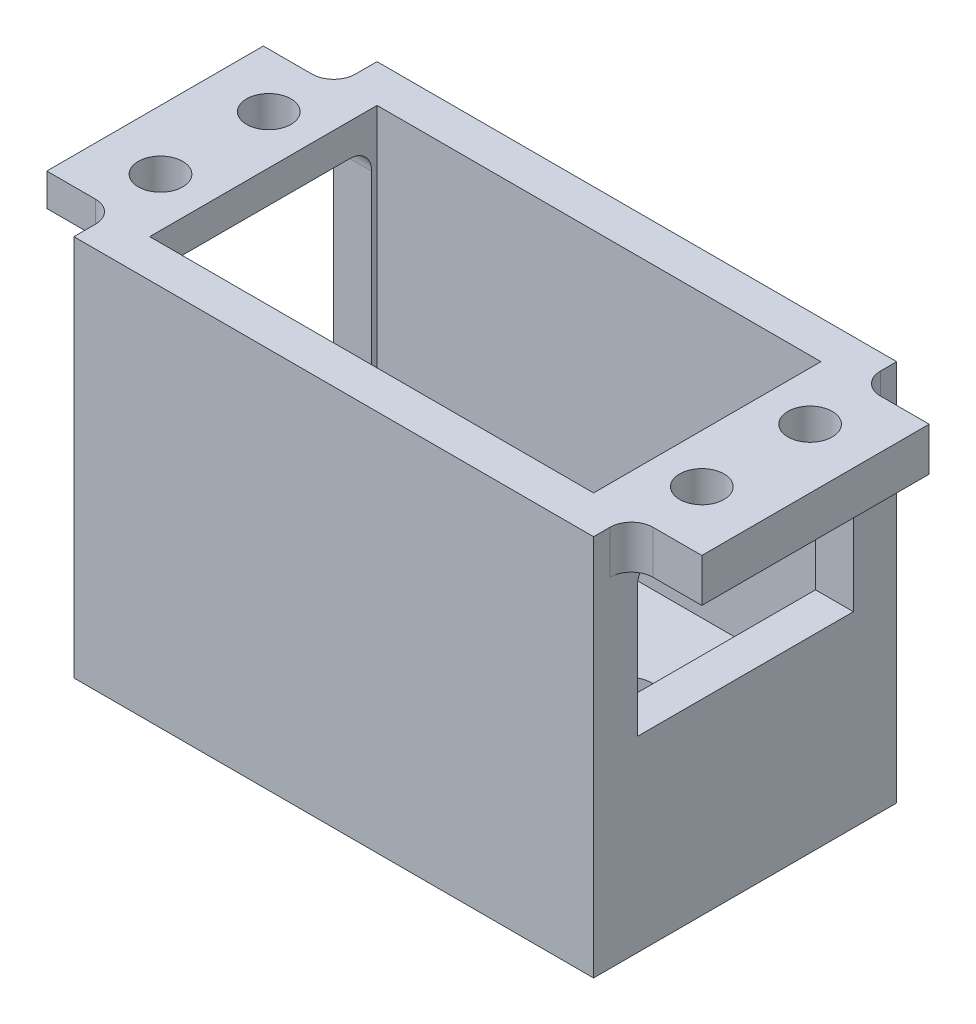
from build123d import *

# Parameters (mm, degrees)
SKETCH_1_W               = 48
SKETCH_1_H               = 28
EXTRUDE_1_DEPTH          = 9.3
SKETCH_2_W               = 48
SKETCH_2_H               = 28
SKETCH_2_W_2             = 40
SKETCH_2_H_2             = 20
EXTRUDE_2_DEPTH          = 26
SKETCH_3_W               = 41
SKETCH_3_H               = 21
CUT_EXTRUDE_1_DEPTH      = 26
SKETCH_4_W               = 19.956885432
SKETCH_4_H               = 18
CUT_EXTRUDE_2_DEPTH      = 10
CUT_EXTRUDE_3_DEPTH      = 6
SKETCH_7_W               = 20
SKETCH_7_H               = 3
EXTRUDE_4_DEPTH          = 10
FILLET_3_R               = 2
SKETCH_9_W               = 21
SKETCH_9_H               = 4
EXTRUDE_5_DEPTH          = 10
SKETCH_10_R              = 2.05
CUT_EXTRUDE_5_DEPTH      = 10
FILLET_4_R               = 2
SKETCH_11_R              = 3
CUT_EXTRUDE_6_DEPTH      = 5.3
CUT_EXTRUDE_7_DEPTH      = 46.890521897
CUT_EXTRUDE_7_DEPTH_BACK = 46.890521897
SKETCH_12_R              = 2.1
FILLET_5_R               = 2


with BuildPart() as part:
    # 草图1 → 凸台-拉伸1 (new body)
    with BuildSketch(Plane(origin=(0, 0, 0), x_dir=(1, 0, 0), z_dir=(0, 1, 0))):
        Rectangle(SKETCH_1_W, SKETCH_1_H)
    extrude(amount=EXTRUDE_1_DEPTH)

    # 草图2 → 凸台-拉伸2 (add)
    with BuildSketch(Plane(origin=(0, 9.3, 0), x_dir=(1, 0, 0), z_dir=(0, 1, 0))):
        Rectangle(SKETCH_2_W, SKETCH_2_H)
        Rectangle(SKETCH_2_W_2, SKETCH_2_H_2, mode=Mode.SUBTRACT)
    extrude(amount=EXTRUDE_2_DEPTH)

    # 草图3 → 切除-拉伸1 (cut)
    with BuildSketch(Plane(origin=(0, 35.3, 0), x_dir=(1, 0, 0), z_dir=(0, 1, 0))):
        Rectangle(SKETCH_3_W, SKETCH_3_H)
    extrude(amount=-CUT_EXTRUDE_1_DEPTH, mode=Mode.SUBTRACT)

    # 草图4 → 切除-拉伸2 (cut)
    with BuildSketch(Plane(origin=(24, 0, 0), x_dir=(0, 0, -1), z_dir=(1, 0, 0))):
        with Locations((0.021557284, 26.3)):
            Rectangle(SKETCH_4_W, SKETCH_4_H)
    extrude(amount=-CUT_EXTRUDE_2_DEPTH, mode=Mode.SUBTRACT)

    # 草图6 → 切除-拉伸3 (cut)
    with BuildSketch(Plane.ZY.offset(24)):
        Polygon((0, 35.3), (-10, 35.3), (-10, 10.3), (10, 10.3), (10, 35.3), align=None)
    extrude(amount=-CUT_EXTRUDE_3_DEPTH, mode=Mode.SUBTRACT)

    # 草图7 → 凸台-拉伸4 (add)
    with BuildSketch(Plane(origin=(-20.5, 0, 0), x_dir=(0, 0, -1), z_dir=(1, 0, 0))):
        with Locations((0, 33.8)):
            Rectangle(SKETCH_7_W, SKETCH_7_H)
    extrude(amount=-EXTRUDE_4_DEPTH)

    # 圆角3
    fillet_3_edges = [part.edges().sort_by_distance(p)[0] for p in [
        (-24, 33.8, 10),
        (-24, 33.8, -10),
    ]]
    fillet(fillet_3_edges, radius=FILLET_3_R)

    # 草图9 → 凸台-拉伸5 (add)
    with BuildSketch(Plane.ZY.offset(-20.5)):
        with Locations((0, 33.3)):
            Rectangle(SKETCH_9_W, SKETCH_9_H)
    extrude(amount=-EXTRUDE_5_DEPTH)

    # 草图10 → 切除-拉伸5 (cut)
    with BuildSketch(Plane(origin=(0, 35.3, 0), x_dir=(1, 0, 0), z_dir=(0, 1, 0))):
        with Locations(Location((25, 5, 0), (0, 0, 270))):
            Circle(SKETCH_10_R)
        with Locations(Location((25, -5, 0), (0, 0, 270))):
            Circle(SKETCH_10_R)
        with Locations(Location((-25, 5, 0), (0, 0, 270))):
            Circle(SKETCH_10_R)
        with Locations(Location((-25, -5, 0), (0, 0, 270))):
            Circle(SKETCH_10_R)
    extrude(amount=-CUT_EXTRUDE_5_DEPTH, mode=Mode.SUBTRACT)

    # 圆角4
    fillet_4_edges = [part.edges().sort_by_distance(p)[0] for p in [
        (24, 33.3, -10.5),
        (24, 33.3, 10.5),
    ]]
    fillet(fillet_4_edges, radius=FILLET_4_R)

    # 草图11 → 切除-拉伸6 (cut)
    with BuildSketch(Plane(origin=(0, 9.3, 0), x_dir=(1, 0, 0), z_dir=(0, 1, 0))):
        with Locations(Location((-14, 0, 0), (0, 0, 270))):
            Circle(SKETCH_11_R)
        with Locations(Location((12.529194913, 0, 0), (0, 0, 270))):
            Circle(SKETCH_11_R)
    extrude(amount=-CUT_EXTRUDE_6_DEPTH, mode=Mode.SUBTRACT)

    # 草图12 → 切除-拉伸7 (cut, two sides: drawn at the far end of the back side and taken through both)
    with BuildSketch(Plane(origin=(0, 4, 0), x_dir=(1, 0, 0), z_dir=(0, 1, 0)).offset(-CUT_EXTRUDE_7_DEPTH_BACK)):
        with Locations(Location((-14, 0, 0), (0, 0, 270))):
            Circle(SKETCH_12_R)
        with Locations(Location((12.529194913, 0, 0), (0, 0, 270))):
            Circle(SKETCH_12_R)
    extrude(amount=CUT_EXTRUDE_7_DEPTH + CUT_EXTRUDE_7_DEPTH_BACK, mode=Mode.SUBTRACT)

    # 圆角5
    fillet_5_edges = [part.edges().sort_by_distance(p)[0] for p in [
        (-22.25, 32.3, -10),
        (-22.25, 32.3, 10),
        (22.25, 31.3, 9.956885432),
        (22.25, 31.3, -10),
    ]]
    fillet(fillet_5_edges, radius=FILLET_5_R)


solid = part.part
